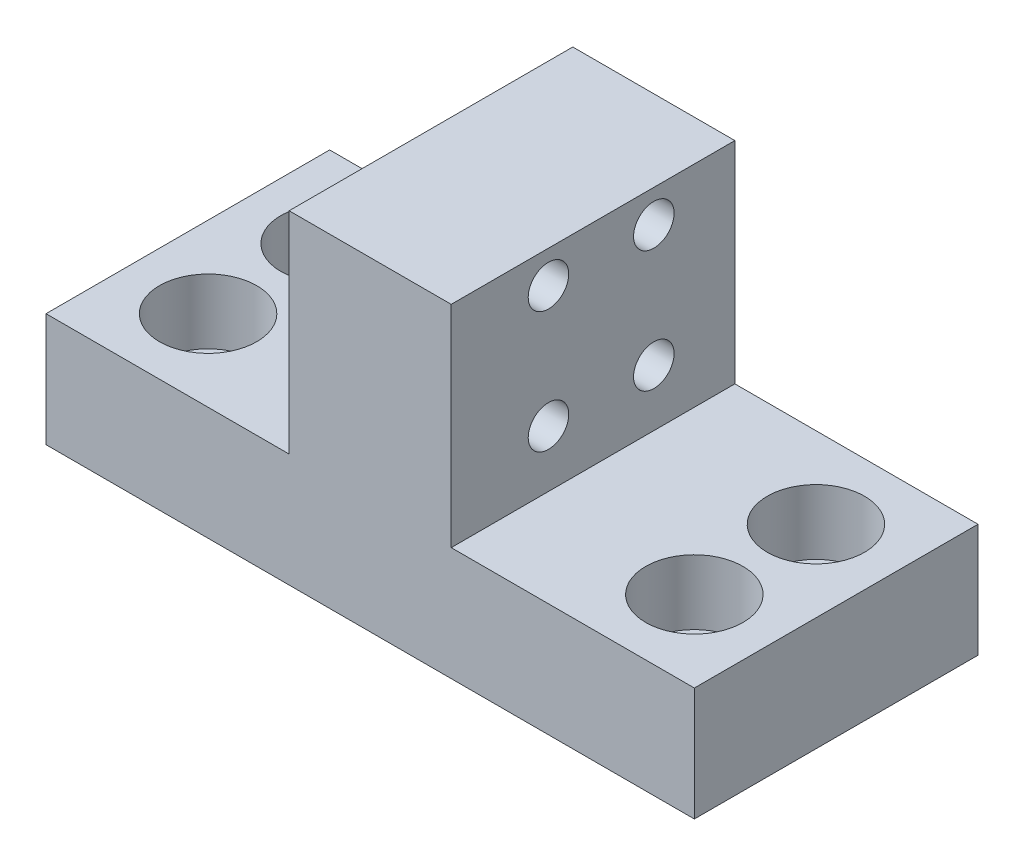
from build123d import *

# Parameters (mm, degrees)
SKETCH_1_W                    = 80
SKETCH_1_H                    = 35
EXTRUDE_1_DEPTH               = 14
SKETCH_2_W                    = 20
SKETCH_2_H                    = 35
EXTRUDE_2_DEPTH               = 26
HOLE_WIZARD_M20_1_D           = 7
HOLE_WIZARD_M20_1_CBORE_D     = 12
HOLE_WIZARD_M20_1_CBORE_DEPTH = 8
PATTERN_LINEAR_1_COUNT        = 2
PATTERN_LINEAR_1_PITCH        = 60
PATTERN_LINEAR_1_COUNT_DIR2   = 2
PATTERN_LINEAR_1_PITCH_DIR2   = 15
SKETCH_5_R                    = 2.5
CUT_EXTRUDE_1_DEPTH           = 67.379590237
PATTERN_LINEAR_2_COUNT        = 2
PATTERN_LINEAR_2_PITCH        = 13
PATTERN_LINEAR_2_COUNT_DIR2   = 2
PATTERN_LINEAR_2_PITCH_DIR2   = 15


with BuildPart() as part:
    # 草图1 → 凸台-拉伸1 (new body)
    with BuildSketch(Plane(origin=(0, 0, 0), x_dir=(1, 0, 0), z_dir=(0, 1, 0))):
        Rectangle(SKETCH_1_W, SKETCH_1_H)
    extrude(amount=EXTRUDE_1_DEPTH)

    # 草图2 → 凸台-拉伸2 (add)
    with BuildSketch(Plane(origin=(0, 14, 0), x_dir=(1, 0, 0), z_dir=(0, 1, 0))):
        Rectangle(SKETCH_2_W, SKETCH_2_H)
    extrude(amount=EXTRUDE_2_DEPTH)

    # M20 六角头螺栓的柱形沉头孔1 (through all)
    with Locations(Plane(origin=(0, 14, 0), x_dir=(1, 0, 0), z_dir=(0, 1, 0))):
        with Locations((-30, 7.5)):
            hole_wizard_m20_1 = CounterBoreHole(HOLE_WIZARD_M20_1_D / 2, HOLE_WIZARD_M20_1_CBORE_D / 2, HOLE_WIZARD_M20_1_CBORE_DEPTH)

    # 阵列(线性)1: Hole Wizard M20 _1 2 × 2
    with Locations(*[(i * PATTERN_LINEAR_1_PITCH, 0, j * PATTERN_LINEAR_1_PITCH_DIR2) for i in range(PATTERN_LINEAR_1_COUNT) for j in range(PATTERN_LINEAR_1_COUNT_DIR2) if (i, j) != (0, 0)]):
        add(hole_wizard_m20_1, mode=Mode.SUBTRACT)

    # 草图5 → 切除-拉伸1 (cut, through all)
    with BuildSketch(Plane.ZY.offset(10)):
        with Locations((-7.5, 21)):
            Circle(SKETCH_5_R)
    cut_extrude_1 = extrude(amount=-CUT_EXTRUDE_1_DEPTH, mode=Mode.SUBTRACT)

    # 阵列(线性)2: Cut-Extrude 1 2 × 2
    with Locations(*[(0, j * PATTERN_LINEAR_2_PITCH_DIR2, i * PATTERN_LINEAR_2_PITCH) for i in range(PATTERN_LINEAR_2_COUNT) for j in range(PATTERN_LINEAR_2_COUNT_DIR2) if (i, j) != (0, 0)]):
        add(cut_extrude_1, mode=Mode.SUBTRACT)


solid = part.part
